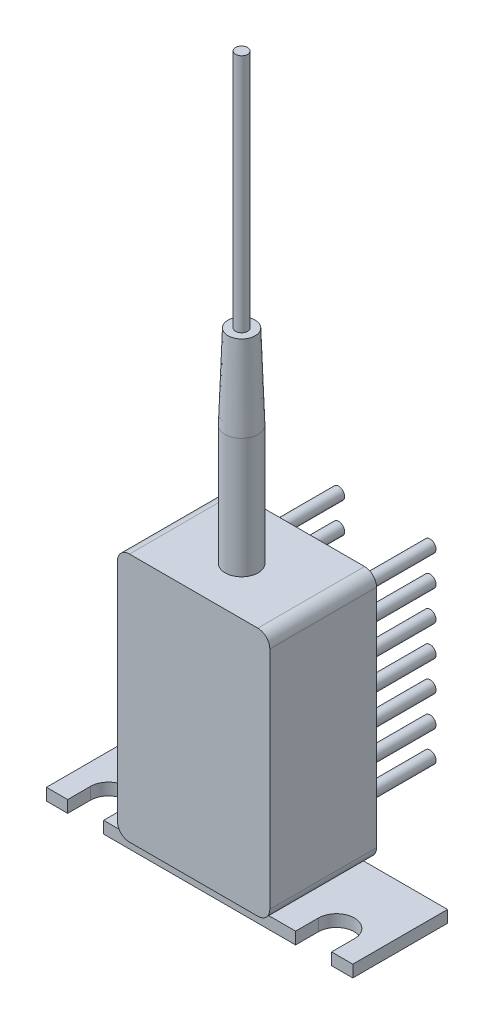
from build123d import *

# Parameters (mm, degrees)
SKETCH_1_W          = 12.7
SKETCH_1_H          = 20.8
EXTRUDE_1_DEPTH     = 8.9
SKETCH_2_R          = 0.5
EXTRUDE_2_DEPTH     = 7
FILLET_1_R          = 1
SKETCH_3_W          = 25.54
SKETCH_3_H          = 7.9
EXTRUDE_3_DEPTH     = 1
CUT_EXTRUDE_1_DEPTH = 27.786617928
SKETCH_5_R          = 1.375
EXTRUDE_4_DEPTH     = 17
CHAMFER_1_SIZE      = 7
CHAMFER_1_SIZE2     = 0.244445386
SKETCH_7_R          = 0.5
EXTRUDE_5_DEPTH     = 20


with BuildPart() as part:
    # 草图1 → 凸台-拉伸1 (new body)
    with BuildSketch(Plane.XY):
        Rectangle(SKETCH_1_W, SKETCH_1_H)
    extrude(amount=EXTRUDE_1_DEPTH)

    # 草图2 → 凸台-拉伸2 (add)
    with BuildSketch(Plane(origin=(0, 0, 0), x_dir=(-1, 0, 0), z_dir=(0, 0, -1))):
        with Locations(Location((-3.81, 0, 0), (0, 0, 180))):
            Circle(SKETCH_2_R)
        with Locations(Location((-3.81, 2.54, 0), (0, 0, 180))):
            Circle(SKETCH_2_R)
        with Locations(Location((-3.81, 5.08, 0), (0, 0, 180))):
            Circle(SKETCH_2_R)
        with Locations(Location((-3.81, 7.62, 0), (0, 0, 180))):
            Circle(SKETCH_2_R)
        with Locations(Location((-3.81, -2.54, 0), (0, 0, 180))):
            Circle(SKETCH_2_R)
        with Locations(Location((-3.81, -5.08, 0), (0, 0, 180))):
            Circle(SKETCH_2_R)
        with Locations(Location((-3.81, -7.62, 0), (0, 0, 180))):
            Circle(SKETCH_2_R)
        with Locations(Location((3.81, -7.62, 0), (0, 0, 180))):
            Circle(SKETCH_2_R)
        with Locations(Location((3.81, -5.08, 0), (0, 0, 180))):
            Circle(SKETCH_2_R)
        with Locations(Location((3.81, -2.54, 0), (0, 0, 180))):
            Circle(SKETCH_2_R)
        with Locations(Location((3.81, 7.62, 0), (0, 0, 180))):
            Circle(SKETCH_2_R)
        with Locations(Location((3.81, 5.08, 0), (0, 0, 180))):
            Circle(SKETCH_2_R)
        with Locations(Location((3.81, 2.54, 0), (0, 0, 180))):
            Circle(SKETCH_2_R)
        with Locations(Location((3.81, 0, 0), (0, 0, 180))):
            Circle(SKETCH_2_R)
    extrude(amount=EXTRUDE_2_DEPTH)

    # 圆角1
    fillet_1_edges = [part.edges().sort_by_distance(p)[0] for p in [
        (-6.35, 10.4, 4.45),
        (6.35, 10.4, 4.45),
        (6.35, -10.4, 4.45),
        (-6.35, -10.4, 4.45),
    ]]
    fillet(fillet_1_edges, radius=FILLET_1_R)

    # 草图3 → 凸台-拉伸3 (add)
    with BuildSketch(Plane.XZ.offset(10.4)):
        with Locations((0, 4.45)):
            Rectangle(SKETCH_3_W, SKETCH_3_H)
    extrude(amount=EXTRUDE_3_DEPTH)

    # 草图4 → 切除-拉伸1 (cut, through all)
    with BuildSketch(Plane.XZ.offset(11.4)):
        with BuildLine():
            Line((8, 6.5), (8, 8.4))
            Line((8, 8.4), (11, 8.4))
            Line((11, 8.4), (11, 6.5))
            ThreePointArc((11, 6.5), (9.5, 5), (8, 6.5))
        make_face()
        with BuildLine():
            Line((-8, 8.4), (-11, 8.4))
            Line((-11, 8.4), (-11, 6.5))
            ThreePointArc((-11, 6.5), (-9.5, 5), (-8, 6.5))
            Line((-8, 6.5), (-8, 8.4))
        make_face()
    extrude(amount=-CUT_EXTRUDE_1_DEPTH, mode=Mode.SUBTRACT)

    # 草图5 → 凸台-拉伸4 (add)
    with BuildSketch(Plane(origin=(0, 10.4, 0), x_dir=(1, 0, 0), z_dir=(0, 1, 0))):
        with Locations(Location((0, -4.9, 0), (0, 0, 90))):
            Circle(SKETCH_5_R)
    extrude(amount=EXTRUDE_4_DEPTH)

    # 倒角1
    chamfer_1_edges = [part.edges().sort_by_distance(p)[0] for p in [
        (0, 27.4, 6.275),
    ]]
    chamfer_1_side = [part.faces().sort_by_distance(p)[0] for p in [
        (0, 18.9, 6.275),
    ]]
    chamfer(chamfer_1_edges, length=CHAMFER_1_SIZE, length2=CHAMFER_1_SIZE2, reference=chamfer_1_side[0])

    # 草图7 → 凸台-拉伸5 (add)
    with BuildSketch(Plane(origin=(0, 27.4, 0), x_dir=(1, 0, 0), z_dir=(0, 1, 0))):
        with Locations(Location((0, -4.9, 0), (0, 0, 270))):
            Circle(SKETCH_7_R)
    extrude(amount=EXTRUDE_5_DEPTH)


solid = part.part
